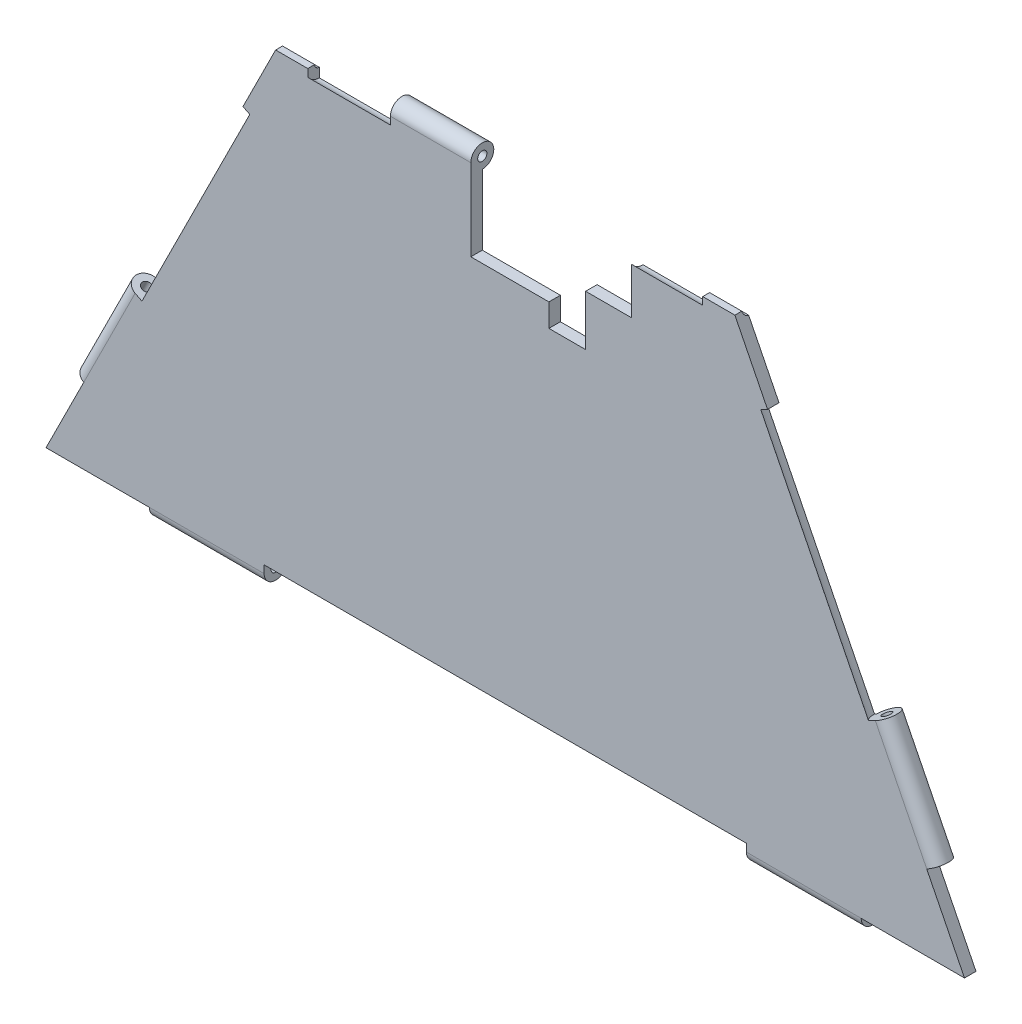
from build123d import *

# Parameters (mm, degrees)
EXTRUDE_1_DEPTH                 = 5
SKETCH_3_W                      = 50
SKETCH_3_H                      = 5
SKETCH_7_W                      = 100
SKETCH_7_H                      = 5
CUT_EXTRUDE_1_DEPTH             = 324.341924284
CUT_EXTRUDE_1_DEPTH_BACK        = 324.341924284
SKETCH_8_R                      = 2
SKETCH_6_W                      = 5
SKETCH_6_H                      = 50
SKETCH_9_R                      = 2
CUT_EXTRUDE_2_DEPTH             = 50
SKETCH_10_R                     = 6
CUT_EXTRUDE_3_DEPTH             = 105
CUT_EXTRUDE_4_REACH             = 369.526
SKETCH_11_R                     = 2
CUT_EXTRUDE_4_DIRECTION_2_REACH = 369.526
SKETCH_12_R                     = 6
CUT_EXTRUDE_5_DEPTH             = 210
SKETCH_13_R                     = 6
CUT_EXTRUDE_6_DEPTH             = 36
SCALE_1_SCALE                   = 0.5
CUT_EXTRUDE_8_DEPTH             = 10


with BuildPart() as part:
    # 草图1 → 凸台-拉伸1 (new body)
    with BuildSketch(Plane.XY):
        Polygon((-200, 0), (-100, 200), (100, 200), (200, 0), align=None)
    extrude(amount=EXTRUDE_1_DEPTH)

    # 草图3 → 旋转5 (revolve)
    with BuildSketch(Plane.XZ):
        with Locations((130, 2.5)):
            Rectangle(SKETCH_3_W, SKETCH_3_H)
        with Locations((-130, 2.5)):
            Rectangle(SKETCH_3_W, SKETCH_3_H)
    revolve(axis=Axis((-155, 0, 0), (1, 0, 0)))

    # 草图7 → 旋转1 (revolve)
    with BuildSketch(Plane(origin=(0, 0, 0), x_dir=(-1, 0, 0), z_dir=(0, 0, -1))):
        with Locations((0, 197.5)):
            Rectangle(SKETCH_7_W, SKETCH_7_H)
    revolve(axis=Axis((50, 200, 0), (-1, 0, 0)))

    # 草图8 → 切除-拉伸1 (cut, two sides: drawn at the far end of the back side and taken through both)
    with BuildSketch(Plane(origin=(50, 0, 0), x_dir=(0, 0, -1), z_dir=(1, 0, 0)).offset(-CUT_EXTRUDE_1_DEPTH_BACK)):
        with Locations(Location((0, 200, 0), (0, 0, 270))):
            Circle(SKETCH_8_R)
    extrude(amount=CUT_EXTRUDE_1_DEPTH + CUT_EXTRUDE_1_DEPTH_BACK, mode=Mode.SUBTRACT)

    # 草图6 → 旋转4 (revolve)
    with BuildSketch(Plane(origin=(-160, 80, 0), x_dir=(0, 0, 1), z_dir=(-0.8944271909999159, 0.44721359549995815, 0))):
        with Locations((2.5, -27.639320225)):
            Rectangle(SKETCH_6_W, SKETCH_6_H)
    revolve_4 = revolve(axis=Axis((-161.180339887, 77.639320225, 0), (-0.447213595499958, -0.894427190999916, 0)))

    # 草图9 → 切除-拉伸2 (cut)
    with BuildSketch(Plane(origin=(-23.541019662, -47.082039325, 0), x_dir=(0.8944271909999156, -0.4472135954999583, 0), z_dir=(-0.4472135954999583, -0.8944271909999156, 0))):
        with Locations((-178.8854382, 0)):
            Circle(SKETCH_9_R)
    cut_extrude_2 = extrude(amount=-CUT_EXTRUDE_2_DEPTH, mode=Mode.SUBTRACT)

    # 草图10 → 切除-拉伸3 (cut)
    with BuildSketch(Plane(origin=(-1.180339887, -2.360679775, 0), x_dir=(0.8944271909999156, -0.4472135954999583, 0), z_dir=(0.4472135954999583, 0.8944271909999156, 0))):
        with Locations((-178.8854382, 0)):
            Circle(SKETCH_10_R)
    cut_extrude_3 = extrude(amount=CUT_EXTRUDE_3_DEPTH, mode=Mode.SUBTRACT)

    # 切除-拉伸4: up to this face of the body (flat: up to its plane)
    cut_extrude_4_end = Plane(part.part.faces().sort_by_distance((155, -0.707355303, -0.707355303))[0])
    # 草图11 → 切除-拉伸4 (cut, up to the picked face)
    with BuildSketch(Plane(origin=(-105, 0, 0), x_dir=(0, 0, -1), z_dir=(1, 0, 0)), mode=Mode.PRIVATE) as cut_extrude_4_sk1:
        with Locations(Location((0, 0, 0), (0, 0, 180))):
            Circle(SKETCH_11_R)
    cut_extrude_4_tool1 = split(extrude(cut_extrude_4_sk1.sketch, amount=CUT_EXTRUDE_4_REACH, mode=Mode.PRIVATE), bisect_by=cut_extrude_4_end, keep=Keep.BOTH, mode=Mode.PRIVATE)
    add(cut_extrude_4_tool1.solids().sort_by(Axis((-105, 0, 0), (1, 0, 0)))[0], mode=Mode.SUBTRACT)

    # 切除-拉伸4 direction 2: up to this face of the body (flat: up to its plane)
    cut_extrude_4_direction_2_end = Plane(part.part.faces().sort_by_distance((-155, -0.707355303, -0.707355303))[0])
    # 草图11 → 切除-拉伸4 direction 2 (cut, up to the picked face)
    with BuildSketch(Plane(origin=(-105, 0, 0), x_dir=(0, 0, -1), z_dir=(1, 0, 0)), mode=Mode.PRIVATE) as cut_extrude_4_direction_2_sk1:
        with Locations(Location((0, 0, 0), (0, 0, 180))):
            Circle(SKETCH_11_R)
    cut_extrude_4_direction_2_tool1 = split(extrude(cut_extrude_4_direction_2_sk1.sketch, amount=-CUT_EXTRUDE_4_DIRECTION_2_REACH, mode=Mode.PRIVATE), bisect_by=cut_extrude_4_direction_2_end, keep=Keep.BOTH, mode=Mode.PRIVATE)
    add(cut_extrude_4_direction_2_tool1.solids().sort_by(Axis((-105, 0, 0), (-1, 0, 0)))[0], mode=Mode.SUBTRACT)

    # 镜向1: 旋转4, 切除-拉伸2, 切除-拉伸3 across plane
    add(revolve_4.mirror(Plane(origin=(0, 0, 0), x_dir=(0, 0, 1), z_dir=(1, 0, 0))))
    add(cut_extrude_2.mirror(Plane(origin=(0, 0, 0), x_dir=(0, 0, 1), z_dir=(1, 0, 0))), mode=Mode.SUBTRACT)
    add(cut_extrude_3.mirror(Plane(origin=(0, 0, 0), x_dir=(0, 0, 1), z_dir=(1, 0, 0))), mode=Mode.SUBTRACT)

    # 草图12 → 切除-拉伸5 (cut)
    with BuildSketch(Plane.ZY.offset(-105)):
        Circle(SKETCH_12_R)
    extrude(amount=CUT_EXTRUDE_5_DEPTH, mode=Mode.SUBTRACT)

    # 草图13 → 切除-拉伸6 (cut)
    with BuildSketch(Plane.ZY.offset(50)):
        with Locations((0, 200)):
            Circle(SKETCH_13_R)
    cut_extrude_6 = extrude(amount=CUT_EXTRUDE_6_DEPTH, mode=Mode.SUBTRACT)

    # 镜向2: 切除-拉伸6 across plane
    add(cut_extrude_6.mirror(Plane(origin=(0, 0, 0), x_dir=(0, 0, 1), z_dir=(1, 0, 0))), mode=Mode.SUBTRACT)


with BuildPart() as part_1:
    # 缩放比例1: scaled about (0, 0, 0)
    add(part.part.scale(SCALE_1_SCALE))

    # 草图18 → 切除-拉伸8 (cut)
    with BuildSketch(Plane.XY.offset(2.5)):
        Polygon((27.5, 98.341687605), (27.5, 88.25), (17.5, 88.25), (17.5, 77.25), (9.5, 77.25), (9.5, 82.25), (-7.5, 82.25), (-7.5, 102.5), (25, 102.5), (25, 98.341687605), align=None)
    extrude(amount=-CUT_EXTRUDE_8_DEPTH, mode=Mode.SUBTRACT)


solid = part_1.part
